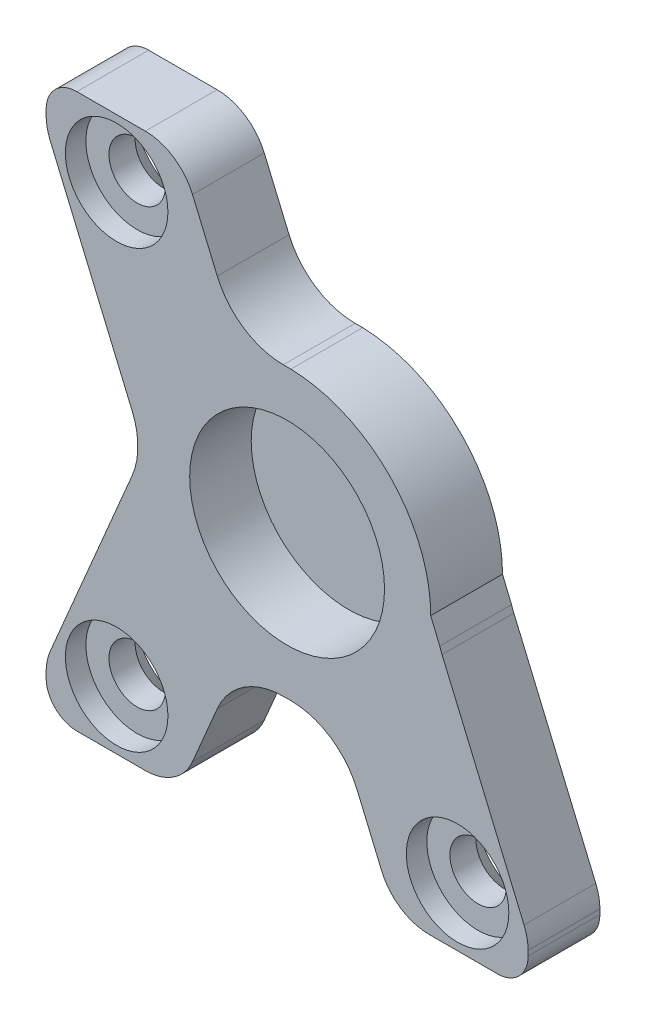
from build123d import *

# Parameters (mm, degrees)
ESBO_O1_W                                            = 47
ESBO_O1_H                                            = 54
RESSALTO_EXTRUS_O1_DEPTH                             = 7
ESBO_O2_R                                            = 9.5
CORTE_EXTRUS_O1_DEPTH                                = 6
CORTE_EXTRUS_O2_DEPTH                                = 37.47259245
FILETE2_R                                            = 7
ESCAREADO_PARA_PARAFUSO_COM_CABE_A_ESCAR_D           = 5.5
ESCAREADO_PARA_PARAFUSO_COM_CABE_A_ESCAR_CSINK_D     = 10.4
ESCAREADO_PARA_PARAFUSO_COM_CABE_A_ESCAR_CSINK_ANGLE = 90
PADR_OCIRCULAR5_COUNT                                = 2
FILETE4_R                                            = 5
FILETE5_R                                            = 3
ESBO_O9_R                                            = 5
CORTE_EXTRUS_O4_DEPTH                                = 2
CORTE_EXTRUS_O5_DEPTH                                = 10


with BuildPart() as part:
    # Esboço1 → Ressalto-extrusão1 (new body)
    with BuildSketch(Plane.XY):
        Rectangle(ESBO_O1_W, ESBO_O1_H)
    extrude(amount=RESSALTO_EXTRUS_O1_DEPTH)

    # Esboço2 → Corte-extrusão1 (cut)
    with BuildSketch(Plane.XY.offset(7)):
        Circle(ESBO_O2_R)
    extrude(amount=-CORTE_EXTRUS_O1_DEPTH, mode=Mode.SUBTRACT)

    # Esboço3 → Corte-extrusão2 (cut, through all)
    with BuildSketch(Plane.XY.offset(7)):
        Polygon((-23.5, 22.5), (-13.949316635, 0), (-23.5, -22.5), align=None)
        Polygon((23.5, 22.5), (23.5, -22.5), (13.949316635, 0), align=None)
        Polygon((-10.518172611, 27), (-5, 14), (5, 14), (10.518172611, 27), align=None)
        Polygon((10.518172611, -27), (5, -14), (-5, -14), (-10.518172611, -27), align=None)
    extrude(amount=-CORTE_EXTRUS_O2_DEPTH, mode=Mode.SUBTRACT)

    # Filete2
    filete2_edges = [part.edges().sort_by_distance(p)[0] for p in [
        (-13.949316635, 0, 3.5),
        (-5, -14, 3.5),
        (5, -14, 3.5),
        (13.949316635, 0, 3.5),
        (5, 14, 3.5),
        (-5, 14, 3.5),
    ]]
    fillet(filete2_edges, radius=FILETE2_R)

    # Escareado para parafuso com cabeça escareada elevada de M52 (through all)
    with Locations(Plane(origin=(0, 0, 0), x_dir=(-1, 0, 0), z_dir=(0, 0, -1))):
        with Locations((-16.622859834, 21.276290347), (16.622859834, 21.276290347)):
            escareado_para_parafuso_com_cabe_a_escar = CounterSinkHole(ESCAREADO_PARA_PARAFUSO_COM_CABE_A_ESCAR_D / 2, ESCAREADO_PARA_PARAFUSO_COM_CABE_A_ESCAR_CSINK_D / 2, counter_sink_angle=ESCAREADO_PARA_PARAFUSO_COM_CABE_A_ESCAR_CSINK_ANGLE)

    # PadrãoCircular5: Escareado para parafuso com cabeça escareada elevada de M52 ×2 about axis
    padr_ocircular5_axis = Axis((0, 0, 0), (0, 0, 1))
    for i in range(1, PADR_OCIRCULAR5_COUNT):
        add(escareado_para_parafuso_com_cabe_a_escar.rotate(padr_ocircular5_axis, i * 360 / PADR_OCIRCULAR5_COUNT), mode=Mode.SUBTRACT)

    # Filete4
    filete4_edges = [part.edges().sort_by_distance(p)[0] for p in [
        (-23.5, -22.5, 3.5),
        (-23.5, 22.5, 3.5),
        (10.518172611, -27, 3.5),
        (-10.518172611, -27, 3.5),
        (23.5, -22.5, 3.5),
        (23.5, 22.5, 3.5),
        (-10.518172611, 27, 3.5),
        (10.518172611, 27, 3.5),
    ]]
    fillet(filete4_edges, radius=FILETE4_R)

    # Filete5
    filete5_edges = [part.edges().sort_by_distance(p)[0] for p in [
        (-23.5, 27, 3.5),
        (23.5, 27, 3.5),
        (23.5, -27, 3.5),
        (-23.5, -27, 3.5),
    ]]
    fillet(filete5_edges, radius=FILETE5_R)

    # Esboço9 → Corte-extrusão4 (cut)
    with BuildSketch(Plane.XY.offset(7)):
        with Locations((-16.622859834, 21.276290347)):
            Circle(ESBO_O9_R)
        with Locations((16.622859834, -21.276290347)):
            Circle(ESBO_O9_R)
        with Locations((16.622859834, 21.276290347)):
            Circle(ESBO_O9_R)
        with Locations((-16.622859834, -21.276290347)):
            Circle(ESBO_O9_R)
    extrude(amount=-CORTE_EXTRUS_O4_DEPTH, mode=Mode.SUBTRACT)

    # Esboço10 → Corte-extrusão5 (cut)
    with BuildSketch(Plane.XY.offset(7)):
        with BuildLine():
            Line((0, 14.004804284), (0, 29.948865899))
            Line((0, 29.948865899), (34.992941628, 29.948865899))
            Line((34.992941628, 29.948865899), (34.992941628, 0))
            Line((34.992941628, 0), (34.992941628, -5.224910789))
            Line((34.992941628, -5.224910789), (16.167159682, -5.224910789))
            Line((16.167159682, -5.224910789), (14.004804284, 0))
            ThreePointArc((14.004804284, 0), (9.902892078, 9.902892078), (0, 14.004804284))
        make_face()
    extrude(amount=-CORTE_EXTRUS_O5_DEPTH, mode=Mode.SUBTRACT)


solid = part.part
